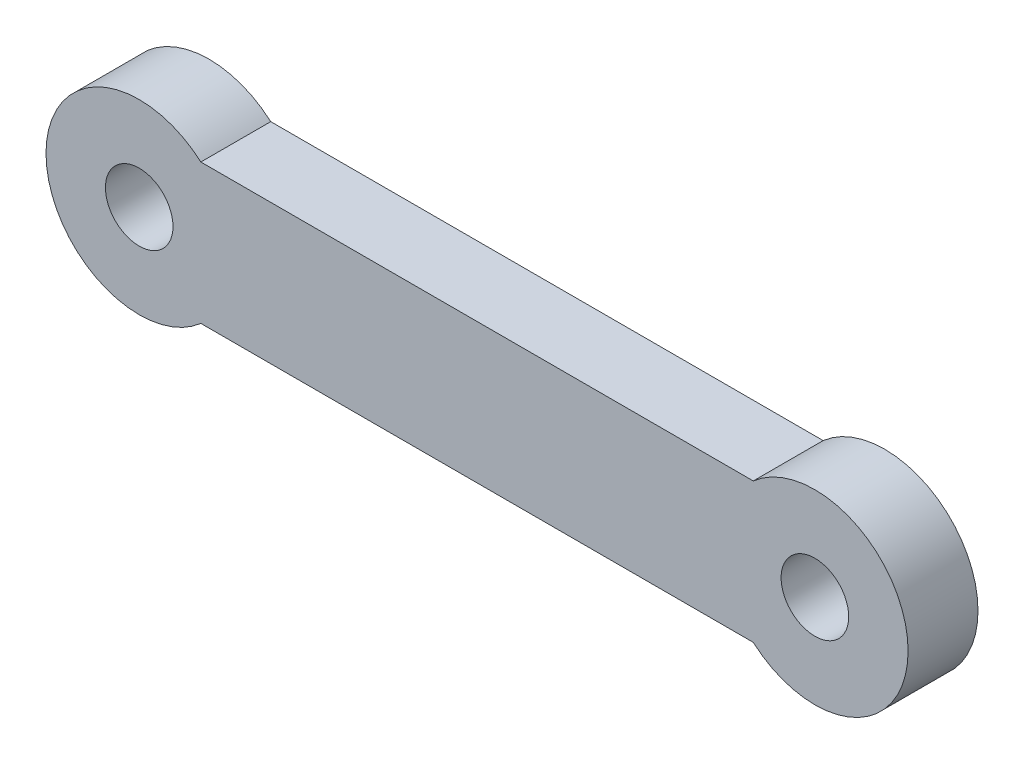
from build123d import *

# Parameters (mm, degrees)
SKETCH_1_R      = 1.45
EXTRUDE_1_DEPTH = 3


with BuildPart() as part:
    # 草图1 → 凸台-拉伸1 (new body)
    with BuildSketch(Plane.XY):
        with BuildLine():
            Line((-29.354248689, -3), (-5.645751311, -3))
            ThreePointArc((-5.645751311, -3), (1, 0), (-5.645751311, 3))
            Line((-5.645751311, 3), (-29.354248689, 3))
            ThreePointArc((-29.354248689, 3), (-36, 0), (-29.354248689, -3))
        make_face()
        with Locations((-3, 0)):
            Circle(SKETCH_1_R, mode=Mode.SUBTRACT)
        with Locations((-32, 0)):
            Circle(SKETCH_1_R, mode=Mode.SUBTRACT)
    extrude(amount=EXTRUDE_1_DEPTH)


solid = part.part
